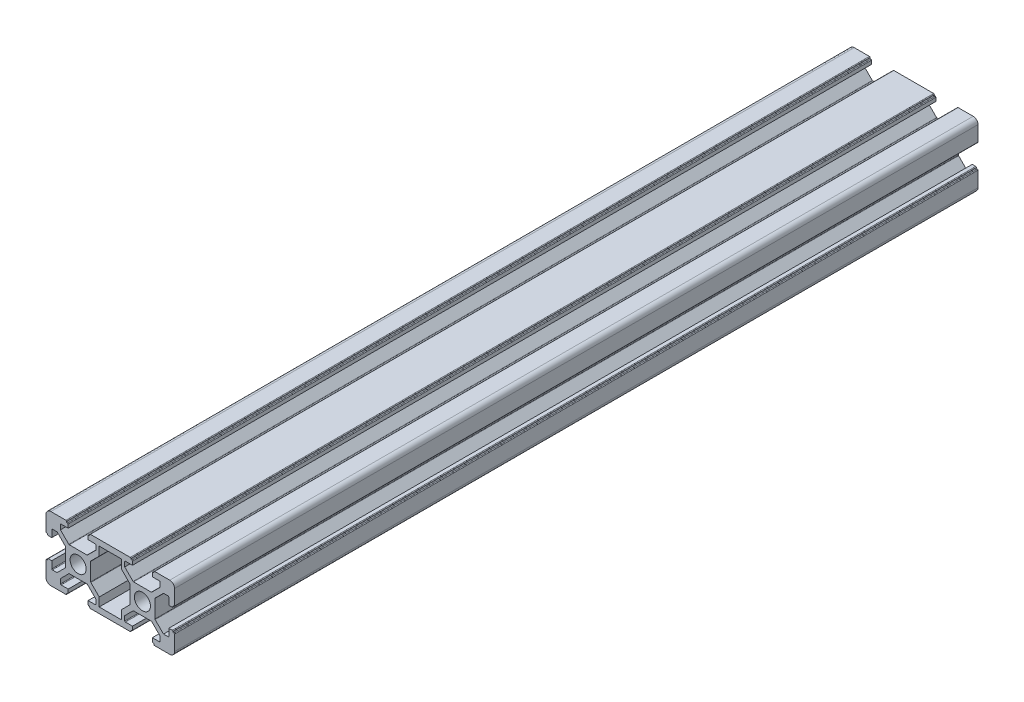
from build123d import *

# Parameters (mm, degrees)
BOSS_EXTRUDE1_DEPTH = 250
SKETCH2_R           = 2.5
CUT_EXTRUDE1_DEPTH  = 252.992063367


with BuildPart() as part:
    # Sketch1 → Boss-Extrude1 (new body)
    with BuildSketch(Plane.XY):
        with BuildLine():
            Line((-8.5, 10), (-3.8, 10))
            ThreePointArc((-3.8, 10), (-3.658578644, 9.941421356), (-3.6, 9.8))
            Line((-3.6, 9.8), (-3.6, 9.7))
            ThreePointArc((-3.6, 9.7), (-3.541421356, 9.558578644), (-3.4, 9.5))
            Line((-3.4, 9.5), (-3.3, 9.5))
            ThreePointArc((-3.3, 9.5), (-3.158578644, 9.441421356), (-3.1, 9.3))
            Line((-3.1, 9.3), (-3.1, 8.2))
            Line((-3.1, 8.2), (-5.3, 8.2))
            ThreePointArc((-5.3, 8.2), (-5.441421356, 8.141421356), (-5.5, 8))
            Line((-5.5, 8), (-5.5, 6.560660172))
            Line((-5.5, 6.560660172), (-2.897918472, 3.958578644))
            ThreePointArc((-2.897918472, 3.958578644), (-2.833033802, 3.915224093), (-2.756497116, 3.9))
            Line((-2.756497116, 3.9), (2.756497116, 3.9))
            ThreePointArc((2.756497116, 3.9), (2.833033802, 3.915224093), (2.897918472, 3.958578644))
            Line((2.897918472, 3.958578644), (5.5, 6.560660172))
            Line((5.5, 6.560660172), (5.5, 8))
            ThreePointArc((5.5, 8), (5.441421356, 8.141421356), (5.3, 8.2))
            Line((5.3, 8.2), (3.1, 8.2))
            Line((3.1, 8.2), (3.1, 9.3))
            ThreePointArc((3.1, 9.3), (3.158578644, 9.441421356), (3.3, 9.5))
            Line((3.3, 9.5), (3.4, 9.5))
            ThreePointArc((3.4, 9.5), (3.541421356, 9.558578644), (3.6, 9.7))
            Line((3.6, 9.7), (3.6, 9.8))
            ThreePointArc((3.6, 9.8), (3.658578644, 9.941421356), (3.8, 10))
            Line((3.8, 10), (8.5, 10))
            Line((8.5, 10), (11.5, 10))
            Line((11.5, 10), (16.2, 10))
            ThreePointArc((16.2, 10), (16.341421356, 9.941421356), (16.4, 9.8))
            Line((16.4, 9.8), (16.4, 9.7))
            ThreePointArc((16.4, 9.7), (16.458578644, 9.558578644), (16.6, 9.5))
            Line((16.6, 9.5), (16.7, 9.5))
            ThreePointArc((16.7, 9.5), (16.841421356, 9.441421356), (16.9, 9.3))
            Line((16.9, 9.3), (16.9, 8.2))
            Line((16.9, 8.2), (14.7, 8.2))
            ThreePointArc((14.7, 8.2), (14.558578644, 8.141421356), (14.5, 8))
            Line((14.5, 8), (14.5, 6.560660172))
            Line((14.5, 6.560660172), (17.102081528, 3.958578644))
            ThreePointArc((17.102081528, 3.958578644), (17.166966198, 3.915224093), (17.243502884, 3.9))
            Line((17.243502884, 3.9), (22.756497116, 3.9))
            ThreePointArc((22.756497116, 3.9), (22.833033802, 3.915224093), (22.897918472, 3.958578644))
            Line((22.897918472, 3.958578644), (25.5, 6.560660172))
            Line((25.5, 6.560660172), (25.5, 8))
            ThreePointArc((25.5, 8), (25.441421356, 8.141421356), (25.3, 8.2))
            Line((25.3, 8.2), (23.1, 8.2))
            Line((23.1, 8.2), (23.1, 9.3))
            ThreePointArc((23.1, 9.3), (23.158578644, 9.441421356), (23.3, 9.5))
            Line((23.3, 9.5), (23.4, 9.5))
            ThreePointArc((23.4, 9.5), (23.541421356, 9.558578644), (23.6, 9.7))
            Line((23.6, 9.7), (23.6, 9.8))
            ThreePointArc((23.6, 9.8), (23.658578644, 9.941421356), (23.8, 10))
            Line((23.8, 10), (28.5, 10))
            ThreePointArc((28.5, 10), (29.560660172, 9.560660172), (30, 8.5))
            Line((30, 8.5), (30, 3.8))
            ThreePointArc((30, 3.8), (29.941421356, 3.658578644), (29.8, 3.6))
            Line((29.8, 3.6), (29.7, 3.6))
            ThreePointArc((29.7, 3.6), (29.558578644, 3.541421356), (29.5, 3.4))
            Line((29.5, 3.4), (29.5, 3.3))
            ThreePointArc((29.5, 3.3), (29.441421356, 3.158578644), (29.3, 3.1))
            Line((29.3, 3.1), (28.2, 3.1))
            Line((28.2, 3.1), (28.2, 5.3))
            ThreePointArc((28.2, 5.3), (28.141421356, 5.441421356), (28, 5.5))
            Line((28, 5.5), (26.560660172, 5.5))
            Line((26.560660172, 5.5), (23.958578644, 2.897918472))
            ThreePointArc((23.958578644, 2.897918472), (23.915224093, 2.833033802), (23.9, 2.756497116))
            Line((23.9, 2.756497116), (23.9, -2.756497116))
            ThreePointArc((23.9, -2.756497116), (23.915224093, -2.833033802), (23.958578644, -2.897918472))
            Line((23.958578644, -2.897918472), (26.560660172, -5.5))
            Line((26.560660172, -5.5), (28, -5.5))
            ThreePointArc((28, -5.5), (28.141421356, -5.441421356), (28.2, -5.3))
            Line((28.2, -5.3), (28.2, -3.1))
            Line((28.2, -3.1), (29.3, -3.1))
            ThreePointArc((29.3, -3.1), (29.441421356, -3.158578644), (29.5, -3.3))
            Line((29.5, -3.3), (29.5, -3.4))
            ThreePointArc((29.5, -3.4), (29.558578644, -3.541421356), (29.7, -3.6))
            Line((29.7, -3.6), (29.8, -3.6))
            ThreePointArc((29.8, -3.6), (29.941421356, -3.658578644), (30, -3.8))
            Line((30, -3.8), (30, -8.5))
            ThreePointArc((30, -8.5), (29.560660172, -9.560660172), (28.5, -10))
            Line((28.5, -10), (23.8, -10))
            ThreePointArc((23.8, -10), (23.658578644, -9.941421356), (23.6, -9.8))
            Line((23.6, -9.8), (23.6, -9.7))
            ThreePointArc((23.6, -9.7), (23.541421356, -9.558578644), (23.4, -9.5))
            Line((23.4, -9.5), (23.3, -9.5))
            ThreePointArc((23.3, -9.5), (23.158578644, -9.441421356), (23.1, -9.3))
            Line((23.1, -9.3), (23.1, -8.2))
            Line((23.1, -8.2), (25.3, -8.2))
            ThreePointArc((25.3, -8.2), (25.441421356, -8.141421356), (25.5, -8))
            Line((25.5, -8), (25.5, -6.560660172))
            Line((25.5, -6.560660172), (22.897918472, -3.958578644))
            ThreePointArc((22.897918472, -3.958578644), (22.833033802, -3.915224093), (22.756497116, -3.9))
            Line((22.756497116, -3.9), (17.243502884, -3.9))
            ThreePointArc((17.243502884, -3.9), (17.166966198, -3.915224093), (17.102081528, -3.958578644))
            Line((17.102081528, -3.958578644), (14.5, -6.560660172))
            Line((14.5, -6.560660172), (14.5, -8))
            ThreePointArc((14.5, -8), (14.558578644, -8.141421356), (14.7, -8.2))
            Line((14.7, -8.2), (16.9, -8.2))
            Line((16.9, -8.2), (16.9, -9.3))
            ThreePointArc((16.9, -9.3), (16.841421356, -9.441421356), (16.7, -9.5))
            Line((16.7, -9.5), (16.6, -9.5))
            ThreePointArc((16.6, -9.5), (16.458578644, -9.558578644), (16.4, -9.7))
            Line((16.4, -9.7), (16.4, -9.8))
            ThreePointArc((16.4, -9.8), (16.341421356, -9.941421356), (16.2, -10))
            Line((16.2, -10), (11.5, -10))
            Line((11.5, -10), (8.5, -10))
            Line((8.5, -10), (3.8, -10))
            ThreePointArc((3.8, -10), (3.658578644, -9.941421356), (3.6, -9.8))
            Line((3.6, -9.8), (3.6, -9.7))
            ThreePointArc((3.6, -9.7), (3.541421356, -9.558578644), (3.4, -9.5))
            Line((3.4, -9.5), (3.3, -9.5))
            ThreePointArc((3.3, -9.5), (3.158578644, -9.441421356), (3.1, -9.3))
            Line((3.1, -9.3), (3.1, -8.2))
            Line((3.1, -8.2), (5.3, -8.2))
            ThreePointArc((5.3, -8.2), (5.441421356, -8.141421356), (5.5, -8))
            Line((5.5, -8), (5.5, -6.560660172))
            Line((5.5, -6.560660172), (2.897918472, -3.958578644))
            ThreePointArc((2.897918472, -3.958578644), (2.833033802, -3.915224093), (2.756497116, -3.9))
            Line((2.756497116, -3.9), (-2.756497116, -3.9))
            ThreePointArc((-2.756497116, -3.9), (-2.833033802, -3.915224093), (-2.897918472, -3.958578644))
            Line((-2.897918472, -3.958578644), (-5.5, -6.560660172))
            Line((-5.5, -6.560660172), (-5.5, -8))
            ThreePointArc((-5.5, -8), (-5.441421356, -8.141421356), (-5.3, -8.2))
            Line((-5.3, -8.2), (-3.1, -8.2))
            Line((-3.1, -8.2), (-3.1, -9.3))
            ThreePointArc((-3.1, -9.3), (-3.158578644, -9.441421356), (-3.3, -9.5))
            Line((-3.3, -9.5), (-3.4, -9.5))
            ThreePointArc((-3.4, -9.5), (-3.541421356, -9.558578644), (-3.6, -9.7))
            Line((-3.6, -9.7), (-3.6, -9.8))
            ThreePointArc((-3.6, -9.8), (-3.658578644, -9.941421356), (-3.8, -10))
            Line((-3.8, -10), (-8.5, -10))
            ThreePointArc((-8.5, -10), (-9.560660172, -9.560660172), (-10, -8.5))
            Line((-10, -8.5), (-10, -3.8))
            ThreePointArc((-10, -3.8), (-9.941421356, -3.658578644), (-9.8, -3.6))
            Line((-9.8, -3.6), (-9.7, -3.6))
            ThreePointArc((-9.7, -3.6), (-9.558578644, -3.541421356), (-9.5, -3.4))
            Line((-9.5, -3.4), (-9.5, -3.3))
            ThreePointArc((-9.5, -3.3), (-9.441421356, -3.158578644), (-9.3, -3.1))
            Line((-9.3, -3.1), (-8.2, -3.1))
            Line((-8.2, -3.1), (-8.2, -5.3))
            ThreePointArc((-8.2, -5.3), (-8.141421356, -5.441421356), (-8, -5.5))
            Line((-8, -5.5), (-6.560660172, -5.5))
            Line((-6.560660172, -5.5), (-3.958578644, -2.897918472))
            ThreePointArc((-3.958578644, -2.897918472), (-3.915224093, -2.833033802), (-3.9, -2.756497116))
            Line((-3.9, -2.756497116), (-3.9, 2.756497116))
            ThreePointArc((-3.9, 2.756497116), (-3.915224093, 2.833033802), (-3.958578644, 2.897918472))
            Line((-3.958578644, 2.897918472), (-6.560660172, 5.5))
            Line((-6.560660172, 5.5), (-8, 5.5))
            ThreePointArc((-8, 5.5), (-8.141421356, 5.441421356), (-8.2, 5.3))
            Line((-8.2, 5.3), (-8.2, 3.1))
            Line((-8.2, 3.1), (-9.3, 3.1))
            ThreePointArc((-9.3, 3.1), (-9.441421356, 3.158578644), (-9.5, 3.3))
            Line((-9.5, 3.3), (-9.5, 3.4))
            ThreePointArc((-9.5, 3.4), (-9.558578644, 3.541421356), (-9.7, 3.6))
            Line((-9.7, 3.6), (-9.8, 3.6))
            ThreePointArc((-9.8, 3.6), (-9.941421356, 3.658578644), (-10, 3.8))
            Line((-10, 3.8), (-10, 8.5))
            ThreePointArc((-10, 8.5), (-9.560660172, 9.560660172), (-8.5, 10))
        make_face()
        with BuildLine():
            Line((3.9, 2.756497116), (3.9, -2.756497116))
            ThreePointArc((3.9, -2.756497116), (3.915224093, -2.833033802), (3.958578644, -2.897918472))
            Line((3.958578644, -2.897918472), (6.560660172, -5.5))
            Line((6.560660172, -5.5), (6.560660172, -8.2))
            Line((6.560660172, -8.2), (13.439339828, -8.2))
            Line((13.439339828, -8.2), (13.439339828, -5.5))
            Line((13.439339828, -5.5), (16.041421356, -2.897918472))
            ThreePointArc((16.041421356, -2.897918472), (16.084775907, -2.833033802), (16.1, -2.756497116))
            Line((16.1, -2.756497116), (16.1, 2.756497116))
            ThreePointArc((16.1, 2.756497116), (16.084775907, 2.833033802), (16.041421356, 2.897918472))
            Line((16.041421356, 2.897918472), (13.439339828, 5.5))
            Line((13.439339828, 5.5), (13.439339828, 8.2))
            Line((13.439339828, 8.2), (6.560660172, 8.2))
            Line((6.560660172, 8.2), (6.560660172, 5.5))
            Line((6.560660172, 5.5), (3.958578644, 2.897918472))
            ThreePointArc((3.958578644, 2.897918472), (3.915224093, 2.833033802), (3.9, 2.756497116))
        make_face(mode=Mode.SUBTRACT)
    extrude(amount=BOSS_EXTRUDE1_DEPTH)

    # Sketch2 → Cut-Extrude1 (cut, through all)
    with BuildSketch(Plane.XY.offset(250)):
        Circle(SKETCH2_R)
        with Locations(Location((20, 0, 0), (0, 0, 180))):
            Circle(SKETCH2_R)
    extrude(amount=-CUT_EXTRUDE1_DEPTH, mode=Mode.SUBTRACT)


solid = part.part
